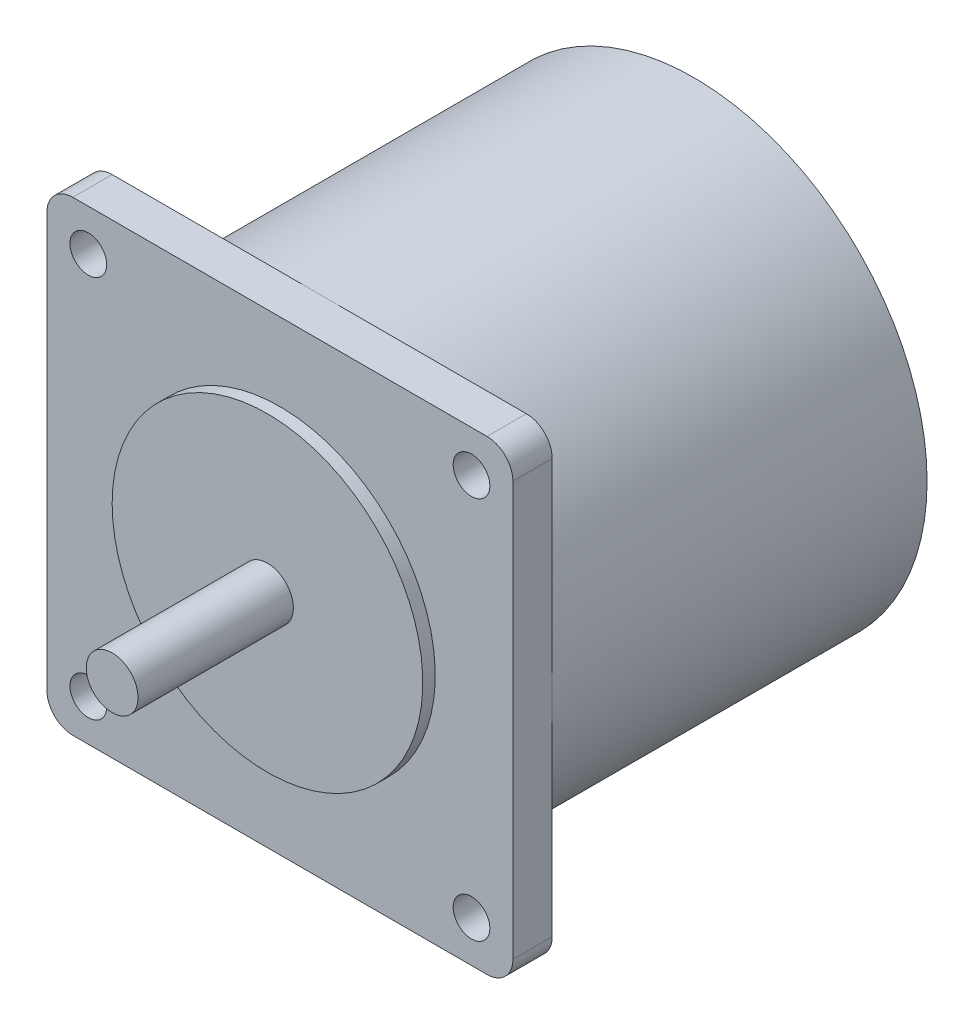
from build123d import *

# Parameters (mm, degrees)
SKETCH1_W            = 57.15
SKETCH1_H            = 57.15
BOSS_EXTRUDE1_DEPTH  = 4.826
SKETCH2_R            = 19.05
BOSS_EXTRUDE2_DEPTH  = 1.524
SKETCH3_R            = 3.175
BOSS_EXTRUDE3_DEPTH  = 20.574
SKETCH5_R            = 28.575
BOSS_EXTRUDE4_DEPTH  = 50.8
M4_CLEARANCE_HOLE1_D = 4.5
FILLET1_R            = 3.175


with BuildPart() as part:
    # Sketch1 → Boss-Extrude1 (new body)
    with BuildSketch(Plane.XY):
        Rectangle(SKETCH1_W, SKETCH1_H)
    extrude(amount=-BOSS_EXTRUDE1_DEPTH)

    # Sketch2 → Boss-Extrude2 (add)
    with BuildSketch(Plane.XY):
        with Locations(Location((0, 0, 0), (0, 0, 180))):
            Circle(SKETCH2_R)
    extrude(amount=BOSS_EXTRUDE2_DEPTH)

    # Sketch3 → Boss-Extrude3 (add)
    with BuildSketch(Plane.XY):
        Circle(SKETCH3_R)
    extrude(amount=BOSS_EXTRUDE3_DEPTH)

    # Sketch5 → Boss-Extrude4 (add)
    with BuildSketch(Plane.XY):
        Circle(SKETCH5_R)
    extrude(amount=-BOSS_EXTRUDE4_DEPTH)

    # M4 Clearance Hole1 (through all)
    with Locations(Plane.XY):
        with Locations((-23.5, 23.5), (23.5, 23.5), (23.5, -23.5), (-23.5, -23.5)):
            Hole(M4_CLEARANCE_HOLE1_D / 2)

    # Fillet1
    fillet1_edges = [part.edges().sort_by_distance(p)[0] for p in [
        (28.575, -28.575, -2.413),
        (-28.575, -28.575, -2.413),
        (-28.575, 28.575, -2.413),
        (28.575, 28.575, -2.413),
    ]]
    fillet(fillet1_edges, radius=FILLET1_R)


solid = part.part
